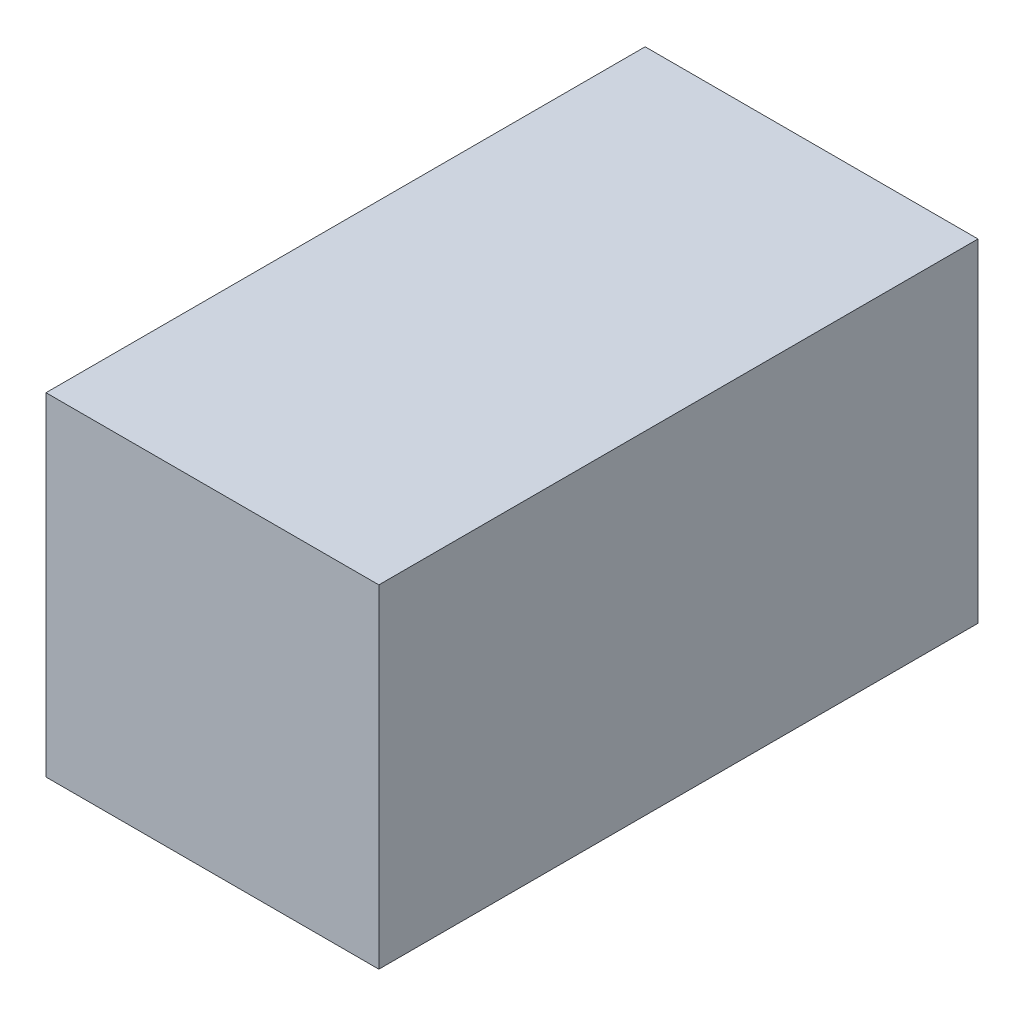
from build123d import *

# Parameters (mm, degrees)
SCHIZZO1_W                   = 400
SCHIZZO1_H                   = 400
ESTRUSIONE_ESTRUSIONE1_DEPTH = 720


with BuildPart() as part:
    # Schizzo1 → Estrusione-Estrusione1 (new body)
    with BuildSketch(Plane(origin=(0, 0, 0), x_dir=(-1, 0, 0), z_dir=(0, 0, -1))):
        Rectangle(SCHIZZO1_W, SCHIZZO1_H)
    extrude(amount=-ESTRUSIONE_ESTRUSIONE1_DEPTH)


solid = part.part
